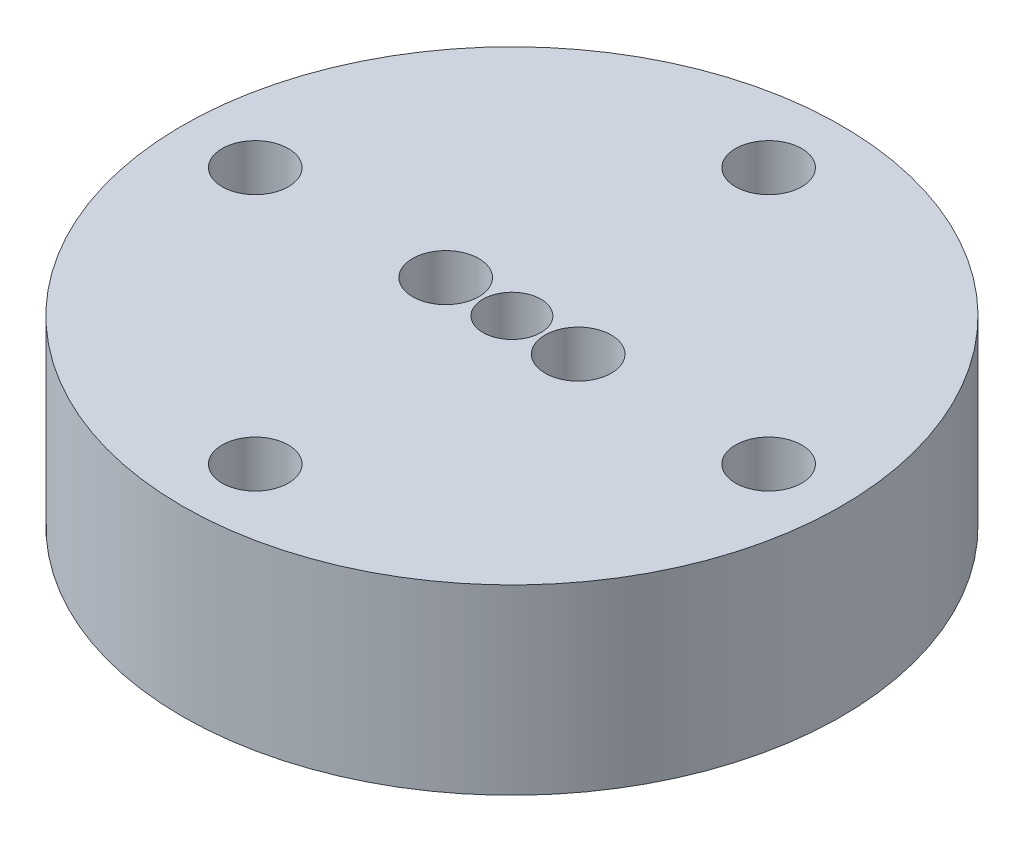
from build123d import *

# Parameters (mm, degrees)
SKETCH1_R           = 19.9
SKETCH1_R_2         = 2
SKETCH1_R_3         = 1.75
BOSS_EXTRUDE1_DEPTH = 11


with BuildPart() as part:
    # Sketch1 → Boss-Extrude1 (new body)
    with BuildSketch(Plane(origin=(0, 0, 0), x_dir=(1, 0, 0), z_dir=(0, 1, 0))):
        with Locations(Location((0, 0, 0), (0, 0, 270))):
            Circle(SKETCH1_R)
        with Locations(Location((0, 15.5, 0), (0, 0, 270))):
            Circle(SKETCH1_R_2, mode=Mode.SUBTRACT)
        with Locations(Location((15.5, 0, 0), (0, 0, 270))):
            Circle(SKETCH1_R_2, mode=Mode.SUBTRACT)
        with Locations(Location((0, -15.5, 0), (0, 0, 270))):
            Circle(SKETCH1_R_2, mode=Mode.SUBTRACT)
        with Locations(Location((-15.5, 0, 0), (0, 0, 270))):
            Circle(SKETCH1_R_2, mode=Mode.SUBTRACT)
        with Locations(Location((-4, 0, 0), (0, 0, 270))):
            Circle(SKETCH1_R_2, mode=Mode.SUBTRACT)
        with Locations(Location((4, 0, 0), (0, 0, 270))):
            Circle(SKETCH1_R_2, mode=Mode.SUBTRACT)
        with Locations(Location((0, 0, 0), (0, 0, 270))):
            Circle(SKETCH1_R_3, mode=Mode.SUBTRACT)
    extrude(amount=BOSS_EXTRUDE1_DEPTH)


solid = part.part
